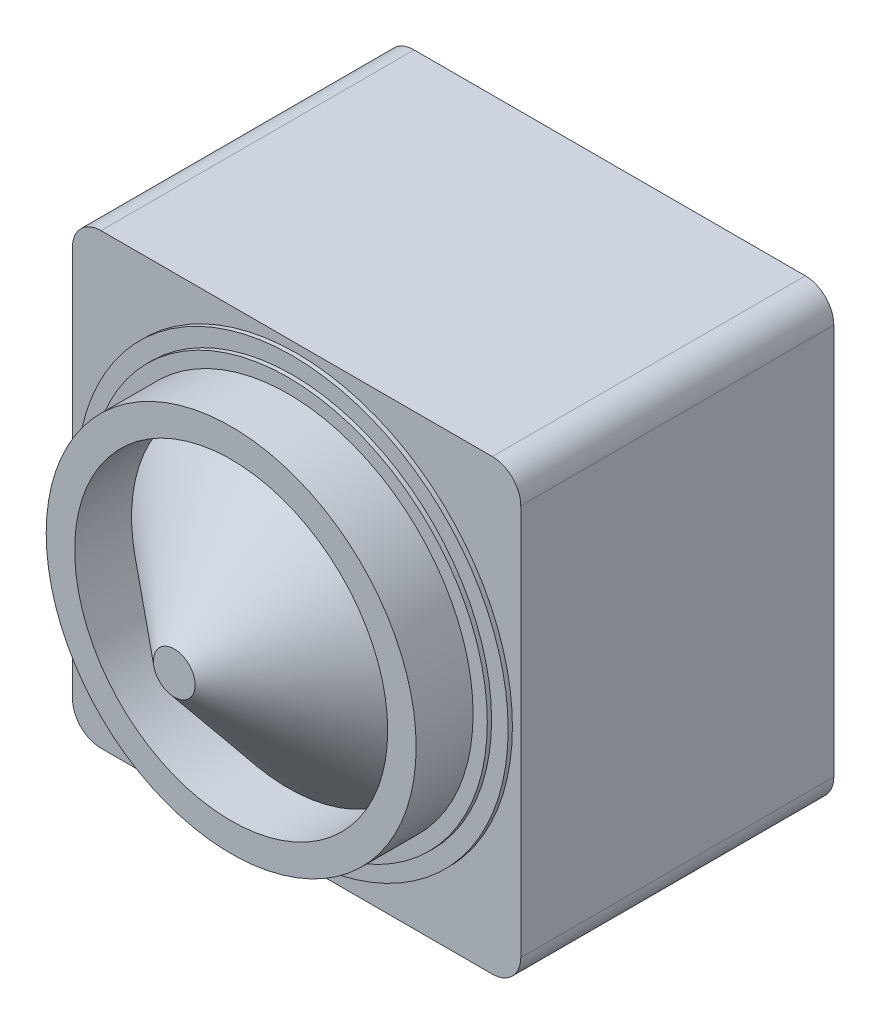
from build123d import *

# Parameters (mm, degrees)
SKETCH1_W           = 31.5
SKETCH1_H           = 31.5
BOSS_EXTRUDE1_DEPTH = 22
FILLET2_R           = 2
SKETCH2_R           = 15.164213562
BOSS_EXTRUDE2_DEPTH = 0.3
SKETCH3_R           = 14
BOSS_EXTRUDE3_DEPTH = 0.3
SKETCH4_R           = 13
SKETCH4_R_2         = 11
BOSS_EXTRUDE5_DEPTH = 4
SKETCH6_R           = 11
BOSS_EXTRUDE6_DEPTH = 8
BOSS_EXTRUDE6_TAPER = 50


with BuildPart() as part:
    # Sketch1 → Boss-Extrude1 (new body)
    with BuildSketch(Plane.XY):
        with Locations((15.75, 15.75)):
            Rectangle(SKETCH1_W, SKETCH1_H)
    extrude(amount=BOSS_EXTRUDE1_DEPTH)

    # Fillet2
    fillet2_edges = [part.edges().sort_by_distance(p)[0] for p in [
        (0, 0, 11),
        (0, 31.5, 11),
        (31.5, 31.5, 11),
        (31.5, 0, 11),
    ]]
    fillet(fillet2_edges, radius=FILLET2_R)

    # Sketch2 → Boss-Extrude2 (add)
    with BuildSketch(Plane.XY.offset(22)):
        with Locations((15.75, 15.75)):
            Circle(SKETCH2_R)
    extrude(amount=BOSS_EXTRUDE2_DEPTH)

    # Sketch3 → Boss-Extrude3 (add)
    with BuildSketch(Plane.XY.offset(22.3)):
        with Locations((15.75, 15.75)):
            Circle(SKETCH3_R)
    extrude(amount=BOSS_EXTRUDE3_DEPTH)

    # Sketch4 → Boss-Extrude5 (add)
    with BuildSketch(Plane.XY.offset(22.6)):
        with Locations((15.75, 15.75)):
            Circle(SKETCH4_R)
        with Locations((15.75, 15.75)):
            Circle(SKETCH4_R_2, mode=Mode.SUBTRACT)
    extrude(amount=BOSS_EXTRUDE5_DEPTH)

    # Sketch6 → Boss-Extrude6 (add)
    with BuildSketch(Plane.XY.offset(22.6)):
        with Locations((15.75, 15.75)):
            Circle(SKETCH6_R)
    extrude(amount=BOSS_EXTRUDE6_DEPTH, taper=BOSS_EXTRUDE6_TAPER)


solid = part.part
